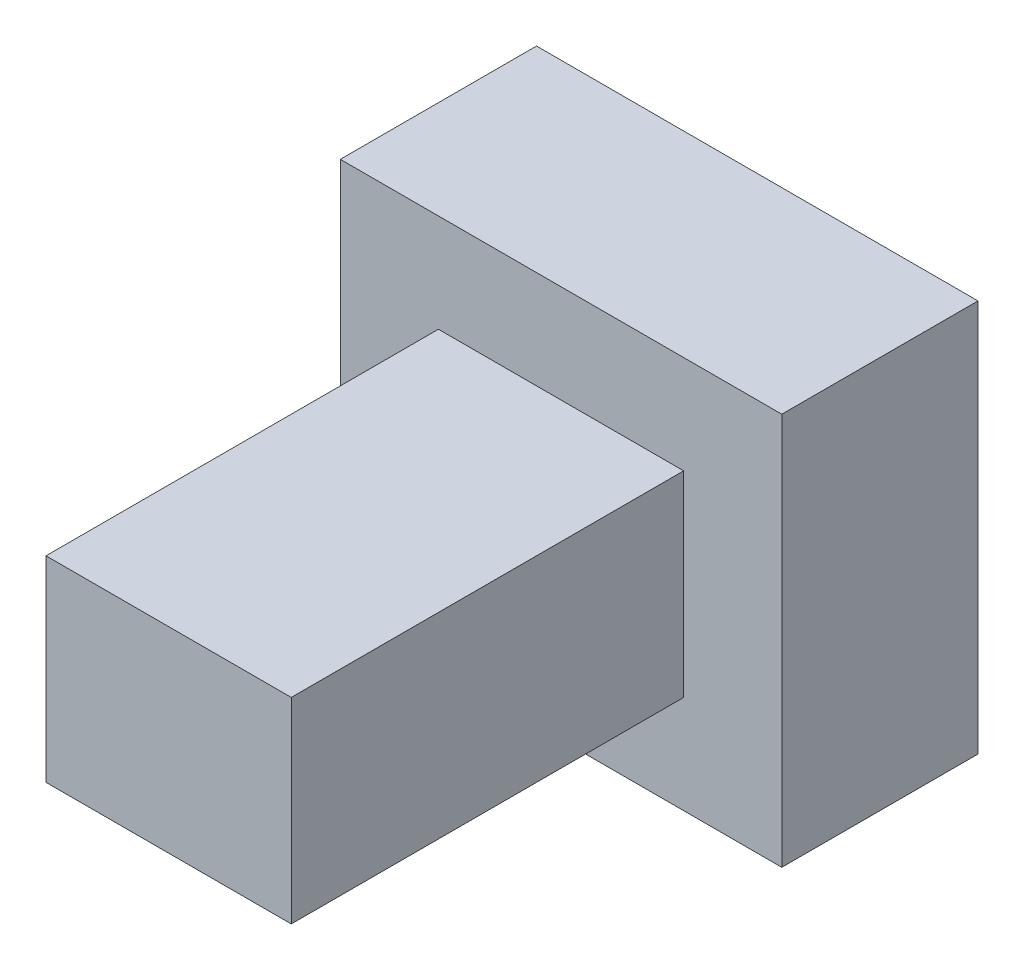
from build123d import *

# Parameters (mm, degrees)
SKETCH_1_W           = 2.5
SKETCH_1_H           = 2
EXTRUDE_1_DEPTH      = 5
EXTRUDE_3_DEPTH      = 1
EXTRUDE_3_DEPTH_BACK = 1
SKETCH_2_W           = 4.5
SKETCH_2_H           = 4
SKETCH_2_W_2         = 2.5
SKETCH_2_H_2         = 2


with BuildPart() as part:
    # 草图1 → 凸台-拉伸1 (new body)
    with BuildSketch(Plane.XY):
        with Locations((1.25, 1)):
            Rectangle(SKETCH_1_W, SKETCH_1_H)
    extrude(amount=EXTRUDE_1_DEPTH)

    # 草图2 → 凸台-拉伸3 (add, two sides: drawn at the far end of the back side and taken through both)
    with BuildSketch(Plane(origin=(0, 0, 0), x_dir=(-1, 0, 0), z_dir=(0, 0, -1)).offset(-EXTRUDE_3_DEPTH_BACK)):
        with Locations((-1.25, 1)):
            Rectangle(SKETCH_2_W, SKETCH_2_H)
        with Locations((-1.25, 1)):
            Rectangle(SKETCH_2_W_2, SKETCH_2_H_2, mode=Mode.SUBTRACT)
    extrude(amount=EXTRUDE_3_DEPTH + EXTRUDE_3_DEPTH_BACK)


solid = part.part
